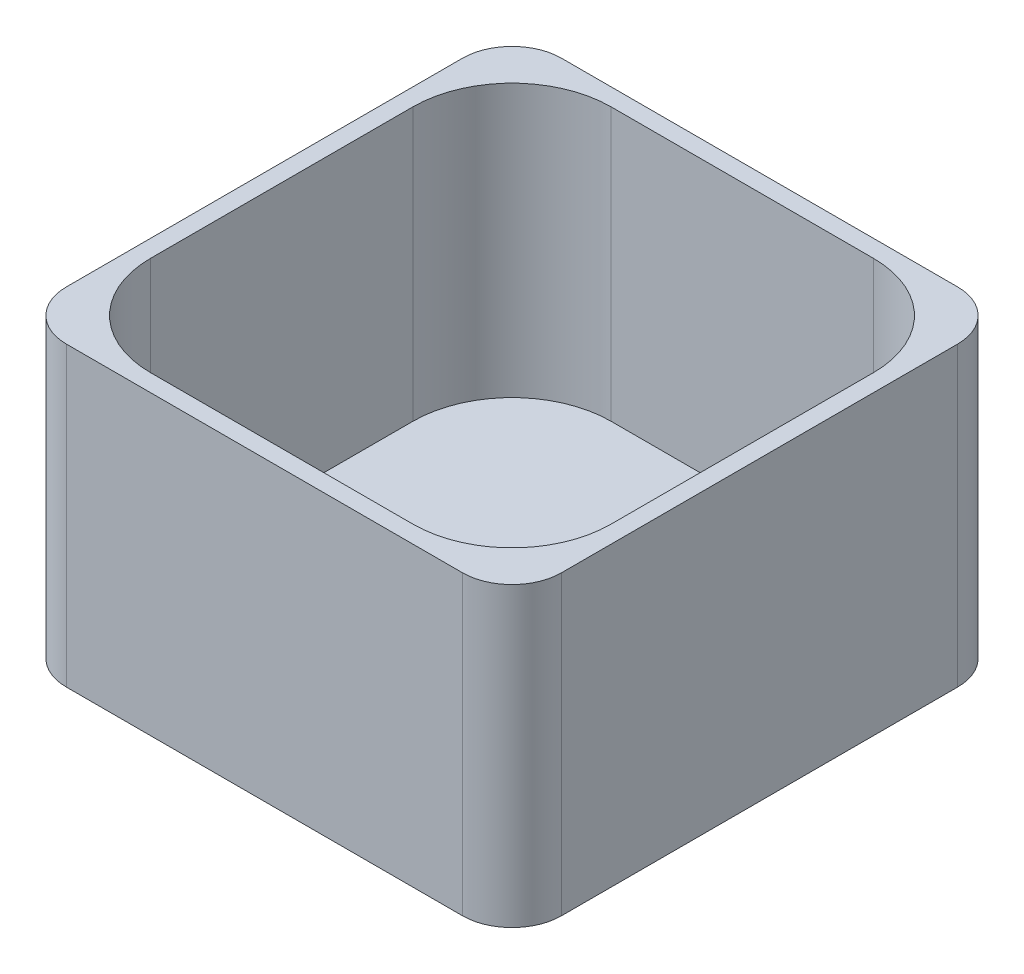
from build123d import *

# Parameters (mm, degrees)
SKETCH1_W           = 100
SKETCH1_H           = 100
BOSS_EXTRUDE1_DEPTH = 60
SKETCH2_W           = 93
SKETCH2_H           = 93
CUT_EXTRUDE1_DEPTH  = 55
SKETCH3_R           = 20
CUT_EXTRUDE2_DEPTH  = 66
FILLET1_R           = 20
FILLET2_R           = 10


with BuildPart() as part:
    # Sketch1 → Boss-Extrude1 (new body)
    with BuildSketch(Plane(origin=(0, 0, 0), x_dir=(1, 0, 0), z_dir=(0, 1, 0))):
        Rectangle(SKETCH1_W, SKETCH1_H)
    extrude(amount=BOSS_EXTRUDE1_DEPTH)

    # Sketch2 → Cut-Extrude1 (cut)
    with BuildSketch(Plane(origin=(0, 60, 0), x_dir=(1, 0, 0), z_dir=(0, 1, 0))):
        Rectangle(SKETCH2_W, SKETCH2_H)
    extrude(amount=-CUT_EXTRUDE1_DEPTH, mode=Mode.SUBTRACT)

    # Sketch3 → Cut-Extrude2 (cut)
    with BuildSketch(Plane(origin=(0, 5, 0), x_dir=(1, 0, 0), z_dir=(0, 1, 0))):
        with Locations(Location((0, 0, 0), (0, 0, 270))):
            Circle(SKETCH3_R)
    extrude(amount=-CUT_EXTRUDE2_DEPTH, mode=Mode.SUBTRACT)

    # Fillet1
    fillet1_edges = [part.edges().sort_by_distance(p)[0] for p in [
        (46.5, 32.5, -46.5),
        (46.5, 32.5, 46.5),
        (-46.5, 32.5, 46.5),
        (-46.5, 32.5, -46.5),
    ]]
    fillet(fillet1_edges, radius=FILLET1_R)

    # Fillet2
    fillet2_edges = [part.edges().sort_by_distance(p)[0] for p in [
        (50, 30, 50),
        (-50, 30, 50),
        (-50, 30, -50),
        (50, 30, -50),
    ]]
    fillet(fillet2_edges, radius=FILLET2_R)


solid = part.part
